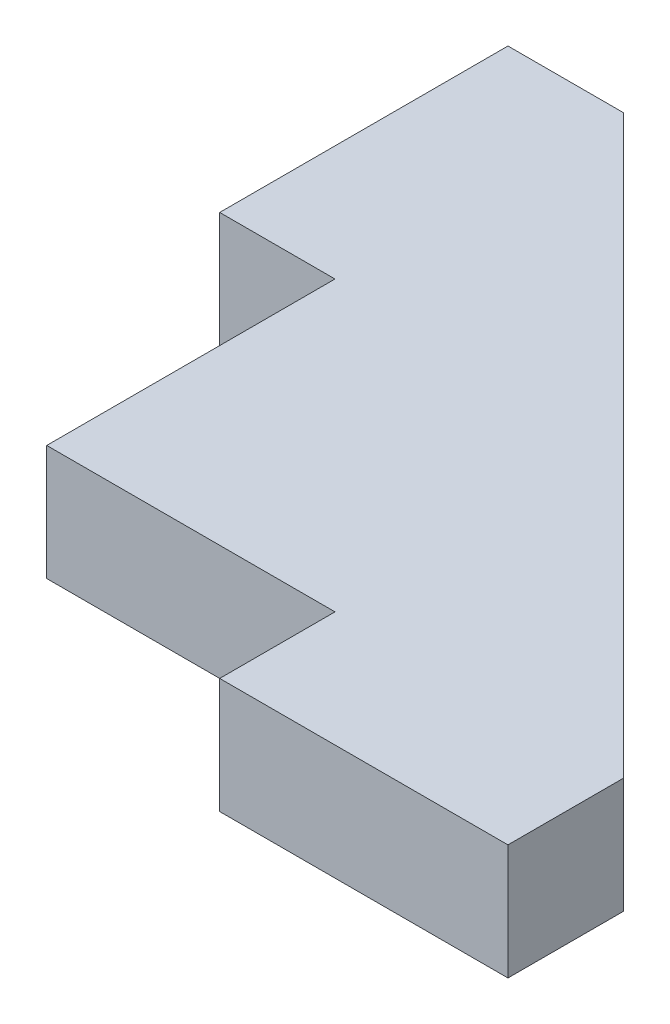
from build123d import *

# Parameters (mm, degrees)
SKETCH1_W           = 2
SKETCH1_H           = 5
SKETCH1_W_2         = 5
SKETCH1_H_2         = 2
BOSS_EXTRUDE1_DEPTH = 2


with BuildPart() as part:
    # Sketch1 → Boss-Extrude1 (new body)
    with BuildSketch(Plane(origin=(0, 0, 0), x_dir=(1, 0, 0), z_dir=(0, 1, 0))):
        Polygon((10, 0), (0, 10), (0, 0), align=None)
        with Locations((-1, 7.5)):
            Rectangle(SKETCH1_W, SKETCH1_H)
        with Locations((7.5, -1)):
            Rectangle(SKETCH1_W_2, SKETCH1_H_2)
    extrude(amount=BOSS_EXTRUDE1_DEPTH)


solid = part.part
